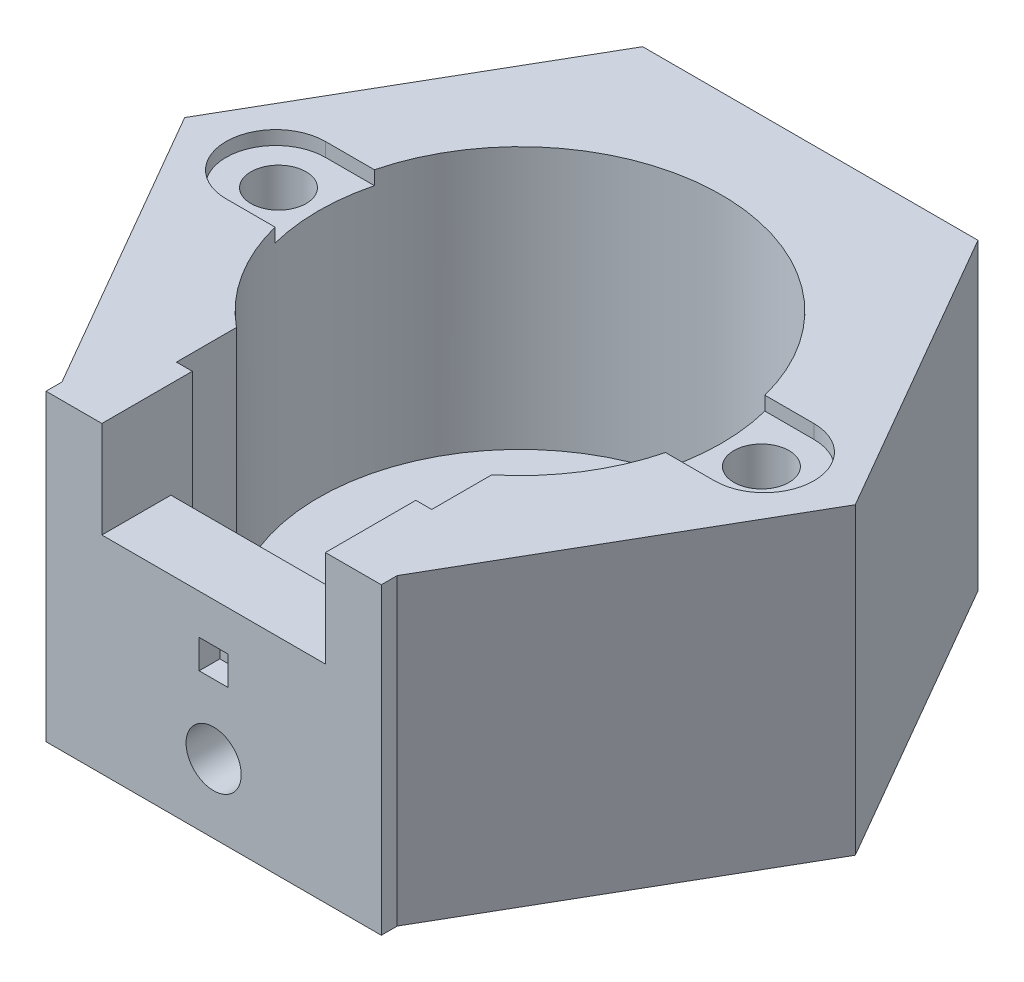
from build123d import *

# Parameters (mm, degrees)
BOSS_EXTRUDE12_DEPTH = 22
SKETCH1_14_R         = 2
BOSS_EXTRUDE13_DEPTH = 21
BOSS_EXTRUDE14_DEPTH = 3
SKETCH1_16_W         = 16.2
SKETCH1_16_H         = 1.552983906
BOSS_EXTRUDE15_DEPTH = 3
SKETCH1_17_W         = 16.2
SKETCH1_17_H         = 3.844417312
BOSS_EXTRUDE16_DEPTH = 15
SKETCH1_18_R         = 2
BOSS_EXTRUDE17_DEPTH = 18
SKETCH1_19_W         = 4.05
SKETCH1_19_H         = 1.155582688
BOSS_EXTRUDE18_DEPTH = 22
SKETCH1_20_W         = 16.2
SKETCH1_20_H         = 1.155582688
BOSS_EXTRUDE19_DEPTH = 15
SKETCH10_R           = 2
CUT_EXTRUDE6_DEPTH   = 3
SKETCH10_10_W        = 2.1
SKETCH10_10_H        = 2.1
CUT_EXTRUDE7_DEPTH   = 1.5
SKETCH1_21_W         = 18.5
SKETCH1_21_H         = 15.647016094
BOSS_EXTRUDE20_DEPTH = 3


with BuildPart() as part:
    # Sketch1 → Boss-Extrude12 (new body)
    with BuildSketch(Plane(origin=(0, 0, 0), x_dir=(1, 0, 0), z_dir=(0, 1, 0))):
        with BuildLine():
            ThreePointArc((-17.7, -3.6), (-21.3, 0), (-17.7, 3.6))
            Line((-17.7, 3.6), (-14.149204925, 3.6))
            ThreePointArc((-14.149204925, 3.6), (0, 14.6), (14.149204925, 3.6))
            Line((14.149204925, 3.6), (17.7, 3.6))
            ThreePointArc((17.7, 3.6), (21.3, 0), (17.7, -3.6))
            Line((17.7, -3.6), (14.149204925, -3.6))
            ThreePointArc((14.149204925, -3.6), (12.316145556, -7.840443778), (9.25, -11.295906338))
            Line((9.25, -11.295906338), (9.25, -15.647016094))
            Line((9.25, -15.647016094), (8.1, -15.647016094))
            Line((8.1, -15.647016094), (8.1, -17.2))
            Line((8.1, -17.2), (8.1, -21.044417312))
            Line((8.1, -21.044417312), (12.15, -21.044417312))
            Line((12.15, -21.044417312), (24.3, 0))
            Line((24.3, 0), (12.15, 21.044417312))
            Line((12.15, 21.044417312), (-12.15, 21.044417312))
            Line((-12.15, 21.044417312), (-24.3, 0))
            Line((-24.3, 0), (-12.15, -21.044417312))
            Line((-12.15, -21.044417312), (-8.1, -21.044417312))
            Line((-8.1, -21.044417312), (-8.1, -17.2))
            Line((-8.1, -17.2), (-8.1, -15.647016094))
            Line((-8.1, -15.647016094), (-9.25, -15.647016094))
            Line((-9.25, -15.647016094), (-9.25, -11.295906338))
            ThreePointArc((-9.25, -11.295906338), (-12.316145556, -7.840443778), (-14.149204925, -3.6))
            Line((-14.149204925, -3.6), (-17.7, -3.6))
        make_face()
    extrude(amount=BOSS_EXTRUDE12_DEPTH)

    # Sketch1<14> → Boss-Extrude13 (add)
    # profile 1 of 2: a face of its own
    with BuildSketch(Plane(origin=(0, 0, 0), x_dir=(1, 0, 0), z_dir=(0, 1, 0))):
        with BuildLine():
            Line((-14.149204925, 3.6), (-17.7, 3.6))
            ThreePointArc((-17.7, 3.6), (-21.3, 0), (-17.7, -3.6))
            Line((-17.7, -3.6), (-14.149204925, -3.6))
            ThreePointArc((-14.149204925, -3.6), (-14.6, 0), (-14.149204925, 3.6))
        make_face()
        with Locations((-17.5, 0)):
            Circle(SKETCH1_14_R, mode=Mode.SUBTRACT)
    # profile 2 of 2: a face of its own
    with BuildSketch(Plane(origin=(0, 0, 0), x_dir=(1, 0, 0), z_dir=(0, 1, 0))):
        with BuildLine():
            Line((17.7, 3.6), (14.149204925, 3.6))
            ThreePointArc((14.149204925, 3.6), (14.6, 0), (14.149204925, -3.6))
            Line((14.149204925, -3.6), (17.7, -3.6))
            ThreePointArc((17.7, -3.6), (21.3, 0), (17.7, 3.6))
        make_face()
        with Locations((17.5, 0)):
            Circle(SKETCH1_14_R, mode=Mode.SUBTRACT)
    extrude(amount=BOSS_EXTRUDE13_DEPTH)

    # Sketch1<15> → Boss-Extrude14 (add)
    with BuildSketch(Plane(origin=(0, 0, 0), x_dir=(1, 0, 0), z_dir=(0, 1, 0))):
        with BuildLine():
            ThreePointArc((14.149204925, 3.6), (0, 14.6), (-14.149204925, 3.6))
            ThreePointArc((-14.149204925, 3.6), (-14.6, 0), (-14.149204925, -3.6))
            ThreePointArc((-14.149204925, -3.6), (-12.316145556, -7.840443778), (-9.25, -11.295906338))
            Line((-9.25, -11.295906338), (-9.25, 0))
            Line((-9.25, 0), (9.25, 0))
            Line((9.25, 0), (9.25, -11.295906338))
            ThreePointArc((9.25, -11.295906338), (12.316145556, -7.840443778), (14.149204925, -3.6))
            ThreePointArc((14.149204925, -3.6), (14.6, 0), (14.149204925, 3.6))
        make_face()
    extrude(amount=BOSS_EXTRUDE14_DEPTH)

    # Sketch1<16> → Boss-Extrude15 (add)
    with BuildSketch(Plane(origin=(0, 0, 0), x_dir=(1, 0, 0), z_dir=(0, 1, 0))):
        with Locations((0, -16.423508047)):
            Rectangle(SKETCH1_16_W, SKETCH1_16_H)
    extrude(amount=BOSS_EXTRUDE15_DEPTH)

    # Sketch1<17> → Boss-Extrude16 (add)
    with BuildSketch(Plane(origin=(0, 0, 0), x_dir=(1, 0, 0), z_dir=(0, 1, 0))):
        with Locations((0, -19.122208656)):
            Rectangle(SKETCH1_17_W, SKETCH1_17_H)
    extrude(amount=BOSS_EXTRUDE16_DEPTH)

    # Sketch1<18> → Boss-Extrude17 (add)
    with BuildSketch(Plane(origin=(0, 0, 0), x_dir=(1, 0, 0), z_dir=(0, 1, 0))):
        with Locations((17.5, 0)):
            Circle(SKETCH1_18_R)
        with Locations((-17.5, 0)):
            Circle(SKETCH1_18_R)
    extrude(amount=BOSS_EXTRUDE17_DEPTH)

    # Sketch1<19> → Boss-Extrude18 (add)
    with BuildSketch(Plane(origin=(0, 0, 0), x_dir=(1, 0, 0), z_dir=(0, 1, 0))):
        with Locations((-10.125, -21.622208656)):
            Rectangle(SKETCH1_19_W, SKETCH1_19_H)
        with Locations((10.125, -21.622208656)):
            Rectangle(SKETCH1_19_W, SKETCH1_19_H)
    extrude(amount=BOSS_EXTRUDE18_DEPTH)

    # Sketch1<20> → Boss-Extrude19 (add)
    with BuildSketch(Plane(origin=(0, 0, 0), x_dir=(1, 0, 0), z_dir=(0, 1, 0))):
        with Locations((0, -21.622208656)):
            Rectangle(SKETCH1_20_W, SKETCH1_20_H)
    extrude(amount=BOSS_EXTRUDE19_DEPTH)

    # Sketch10 → Cut-Extrude6 (cut)
    with BuildSketch(Plane.XY.offset(22.2)):
        with Locations((0, 5)):
            Circle(SKETCH10_R)
    extrude(amount=-CUT_EXTRUDE6_DEPTH, mode=Mode.SUBTRACT)

    # Sketch10<10> → Cut-Extrude7 (cut)
    with BuildSketch(Plane.XY.offset(22.2)):
        with Locations((0, 11.05)):
            Rectangle(SKETCH10_10_W, SKETCH10_10_H)
    extrude(amount=-CUT_EXTRUDE7_DEPTH, mode=Mode.SUBTRACT)

    # Sketch1<21> → Boss-Extrude20 (add)
    with BuildSketch(Plane(origin=(0, 0, 0), x_dir=(1, 0, 0), z_dir=(0, 1, 0))):
        with Locations((0, -7.823508047)):
            Rectangle(SKETCH1_21_W, SKETCH1_21_H)
    extrude(amount=BOSS_EXTRUDE20_DEPTH)


solid = part.part
